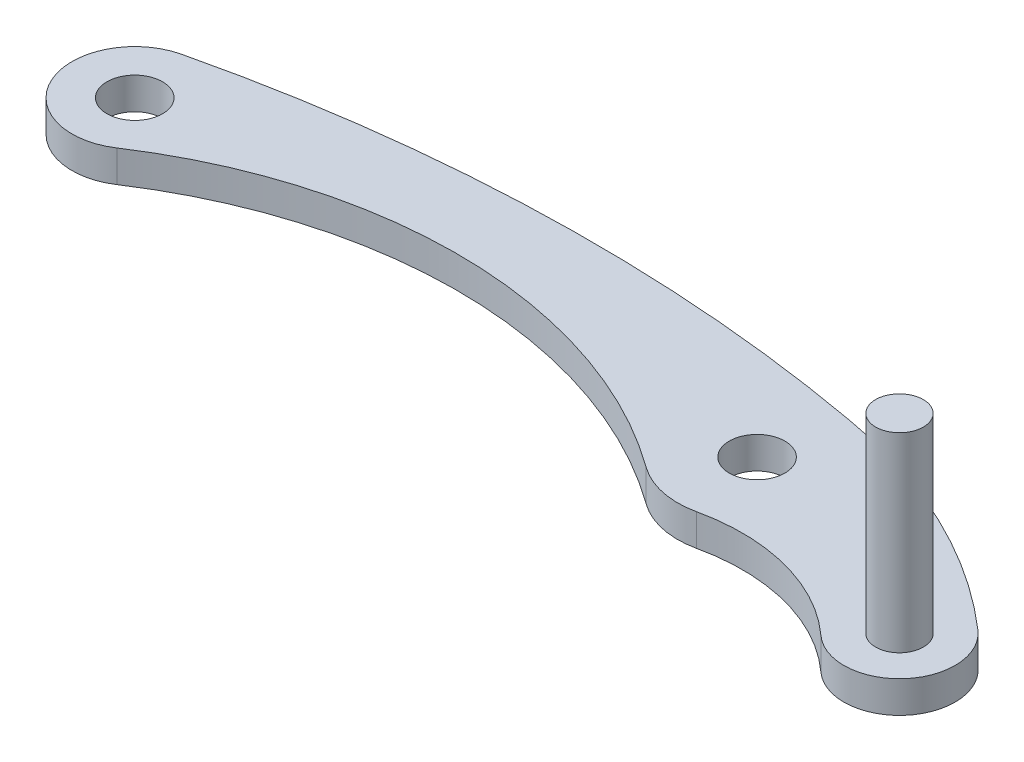
from build123d import *

# Parameters (mm, degrees)
SKETCH1_R           = 1.75
SKETCH1_R_2         = 3.5
BOSS_EXTRUDE3_DEPTH = 2
SKETCH3_R           = 1.5
BOSS_EXTRUDE4_DEPTH = 12


with BuildPart() as part:
    # Sketch1 → Boss-Extrude3 (new body)
    # profile 1 of 2: a face of its own
    with BuildSketch(Plane(origin=(0, 0, 0), x_dir=(1, 0, 0), z_dir=(0, 1, 0))):
        with BuildLine():
            ThreePointArc((40.05780493, 4.92208645), (19.51761867, 6.504088301), (-0.91087774, 3.843540262))
            ThreePointArc((-0.91087774, 3.843540262), (-3.626704772, -1.56509185), (2.171657179, -3.299455273))
            ThreePointArc((2.171657179, -3.299455273), (19.326940327, 1.634092765), (36.247955143, -4.051229892))
            ThreePointArc((36.247955143, -4.051229892), (38.163769521, -4.895969245), (40.257507506, -4.882165276))
            ThreePointArc((40.257507506, -4.882165276), (45.933967375, -5.003120525), (50.919436714, -7.720089844))
            ThreePointArc((50.919436714, -7.720089844), (50.66068815, -2.80185284), (55.57610439, -2.494136696))
            ThreePointArc((55.57610439, -2.494136696), (48.324550131, 2.276108307), (40.05780493, 4.92208645))
        make_face()
        with Locations(Location((0, 0, 0), (0, 0, 270))):
            Circle(SKETCH1_R, mode=Mode.SUBTRACT)
        with Locations(Location((39.178405, 0, 0), (0, 0, 270))):
            Circle(SKETCH1_R, mode=Mode.SUBTRACT)
    # profile 2 of 2: a face of its own
    with BuildSketch(Plane(origin=(0, 0, 0), x_dir=(1, 0, 0), z_dir=(0, 1, 0))):
        with Locations((53.273794312, -5.13030215)):
            Circle(SKETCH1_R_2)
    extrude(amount=BOSS_EXTRUDE3_DEPTH)

    # Sketch3 → Boss-Extrude4 (add)
    with BuildSketch(Plane(origin=(0, 2, 0), x_dir=(1, 0, 0), z_dir=(0, 1, 0))):
        with Locations(Location((53.273794312, -5.13030215, 0), (0, 0, 270))):
            Circle(SKETCH3_R)
    extrude(amount=BOSS_EXTRUDE4_DEPTH)


solid = part.part
